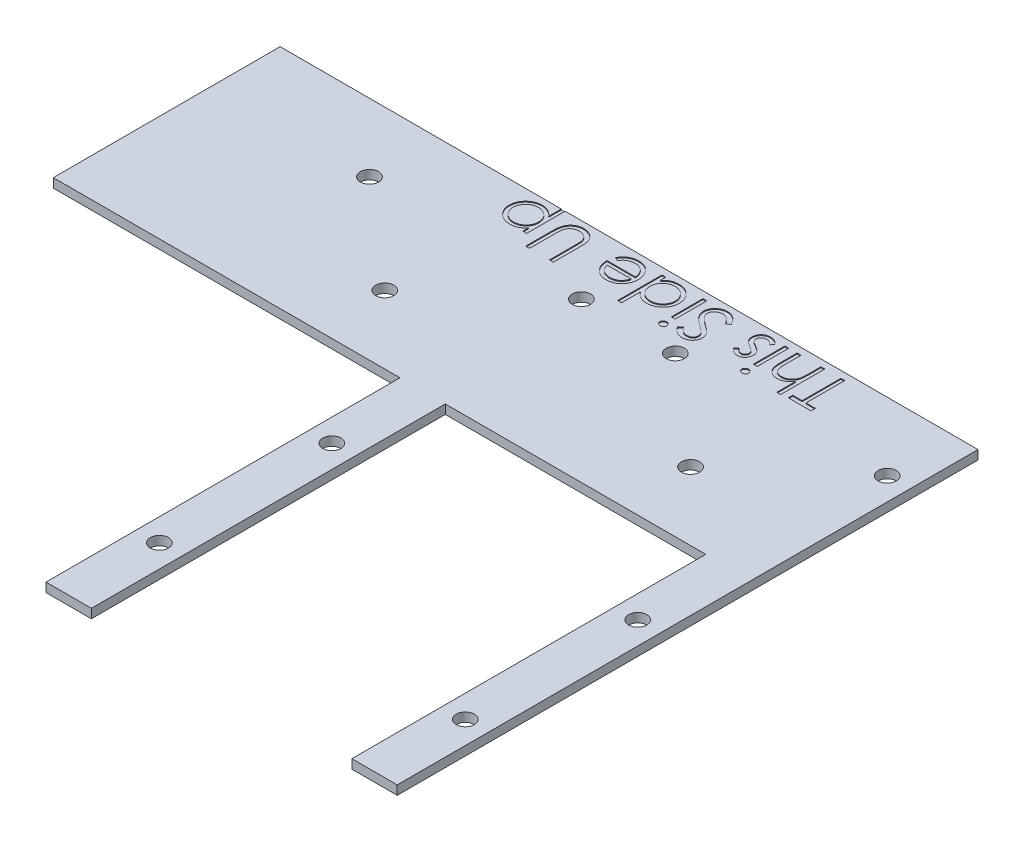
from build123d import *

# Parameters (mm, degrees)
SKETCH1_W           = 2
SKETCH1_H           = 50
SKETCH1_R           = 2
SKETCH1_W_2         = 8.7
SKETCH1_W_3         = 10
SKETCH1_H_2         = 78
SKETCH1_W_4         = 29.7
BOSS_EXTRUDE1_DEPTH = 2
SKETCH2_W           = 0.854807693
SKETCH2_H           = 6.960576923
CUT_EXTRUDE1_DEPTH  = 0.2


with BuildPart() as part:
    # Sketch1 → Boss-Extrude1 (new body)
    # profile 1 of 7: a face of its own
    with BuildSketch(Plane(origin=(0, 0, 0), x_dir=(1, 0, 0), z_dir=(0, 1, 0))):
        with Locations((38.05, 0)):
            Rectangle(SKETCH1_W, SKETCH1_H)
    # profile 2 of 7: a face of its own
    with BuildSketch(Plane(origin=(0, 0, 0), x_dir=(1, 0, 0), z_dir=(0, 1, 0))):
        Polygon((95.75, 25), (39.05, 25), (39.05, -25), (85.75, -25), (95.75, -25), align=None)
        with Locations(Location((67.4, -10, 0), (0, 0, 270))):
            Circle(SKETCH1_R, mode=Mode.SUBTRACT)
        with Locations(Location((44.05, 10, 0), (0, 0, 270))):
            Circle(SKETCH1_R, mode=Mode.SUBTRACT)
        with Locations(Location((90.75, 10, 0), (0, 0, 270))):
            Circle(SKETCH1_R, mode=Mode.SUBTRACT)
    # profile 3 of 7: a face of its own
    with BuildSketch(Plane(origin=(0, 0, 0), x_dir=(1, 0, 0), z_dir=(0, 1, 0))):
        with Locations((32.7, 0)):
            Rectangle(SKETCH1_W_2, SKETCH1_H)
    # profile 4 of 7: a face of its own
    with BuildSketch(Plane(origin=(0, 0, 0), x_dir=(1, 0, 0), z_dir=(0, 1, 0))):
        with Locations((90.75, -64)):
            Rectangle(SKETCH1_W_3, SKETCH1_H_2)
        with Locations(Location((90.75, -83, 0), (0, 0, 270))):
            Circle(SKETCH1_R, mode=Mode.SUBTRACT)
        with Locations(Location((90.75, -45, 0), (0, 0, 270))):
            Circle(SKETCH1_R, mode=Mode.SUBTRACT)
    # profile 5 of 7: a face of its own
    with BuildSketch(Plane(origin=(0, 0, 0), x_dir=(1, 0, 0), z_dir=(0, 1, 0))):
        Polygon((28.35, -25), (28.35, 25), (-28.35, 25), (-28.35, -25), (18.35, -25), align=None)
        with Locations(Location((0, -10, 0), (0, 0, 270))):
            Circle(SKETCH1_R, mode=Mode.SUBTRACT)
        with Locations(Location((-23.35, 10, 0), (0, 0, 270))):
            Circle(SKETCH1_R, mode=Mode.SUBTRACT)
        with Locations(Location((23.35, 10, 0), (0, 0, 270))):
            Circle(SKETCH1_R, mode=Mode.SUBTRACT)
    # profile 6 of 7: a face of its own
    with BuildSketch(Plane(origin=(0, 0, 0), x_dir=(1, 0, 0), z_dir=(0, 1, 0))):
        with Locations((-43.2, 0)):
            Rectangle(SKETCH1_W_4, SKETCH1_H)
    # profile 7 of 7: a face of its own
    with BuildSketch(Plane(origin=(0, 0, 0), x_dir=(1, 0, 0), z_dir=(0, 1, 0))):
        with Locations((23.35, -64)):
            Rectangle(SKETCH1_W_3, SKETCH1_H_2)
        with Locations(Location((23.35, -83, 0), (0, 0, 270))):
            Circle(SKETCH1_R, mode=Mode.SUBTRACT)
        with Locations(Location((23.35, -45, 0), (0, 0, 270))):
            Circle(SKETCH1_R, mode=Mode.SUBTRACT)
    extrude(amount=BOSS_EXTRUDE1_DEPTH)

    # Sketch2 → Cut-Extrude1 (cut)
    # profile 1 of 12: a face of its own
    with BuildSketch(Plane(origin=(0, 2, 0), x_dir=(1, 0, 0), z_dir=(0, 1, 0))):
        with BuildLine():
            Line((4.759615385, 16.539423077), (3.904807692, 16.539423077))
            Line((3.904807692, 16.539423077), (3.904807692, 17.827358774))
            add(Edge.make_bspline(
                [(3.904807692, 17.827358774), (3.813743751, 17.711435136), (3.636217432, 17.485445611), (3.334891802, 17.188412777), (3.009625504, 16.944809007), (2.665842405, 16.747320075), (2.300156627, 16.600726472), (1.916667217, 16.492715786), (1.5110623, 16.428897878), (1.233759293, 16.421222204), (1.09233774, 16.417307692)],
                knots=[0, 0, 0, 0, 1.079470681, 2.104394496, 3.089609837, 4.049760214, 5.000876222, 5.968810619, 6.964115249, 8, 8, 8, 8], degree=3))
            add(Edge.make_bspline(
                [(1.09233774, 16.417307692), (0.968807735, 16.420881415), (0.724644189, 16.427945065), (0.365243544, 16.475768878), (0.019144822, 16.557732027), (-0.311693954, 16.675844518), (-0.63081701, 16.821864047), (-0.93350001, 17.006151122), (-1.224457615, 17.21952797), (-1.496372387, 17.465088323), (-1.747618394, 17.730776677), (-1.964914073, 18.016587376), (-2.152344041, 18.313121272), (-2.303846776, 18.624975466), (-2.422523779, 18.949694227), (-2.506928009, 19.288589484), (-2.557159167, 19.640404722), (-2.563898653, 19.879625697), (-2.567307692, 20.00063101)],
                knots=[0, 0, 0, 0, 1.041296284, 2.058176809, 3.050446431, 4.034000596, 5.01514041, 6.003636468, 7.015969324, 8.052561599, 9.08815499, 10.094063707, 11.074456064, 12.040834395, 13.011057502, 13.983766392, 14.980127149, 16, 16, 16, 16], degree=3))
            add(Edge.make_bspline(
                [(-2.567307692, 20.00063101), (-2.56399116, 20.124197219), (-2.557450479, 20.367887615), (-2.506171134, 20.725618866), (-2.425575201, 21.070427212), (-2.304768233, 21.399031178), (-2.156859662, 21.716185117), (-1.971794206, 22.016529091), (-1.754652263, 22.302926359), (-1.506106127, 22.570545784), (-1.236573931, 22.817144497), (-0.948381668, 23.032673792), (-0.645829282, 23.214455158), (-0.330363027, 23.364178519), (-0.000880744, 23.479575436), (0.342439899, 23.561267019), (0.699673309, 23.612089542), (0.942705705, 23.61874781), (1.065625, 23.622115385)],
                knots=[0, 0, 0, 0, 1.038787011, 2.048637893, 3.033314735, 4.011256821, 4.987456671, 5.971770257, 6.972013799, 8.005388554, 9.039095487, 10.040396776, 11.026510796, 12.002710647, 12.972028308, 13.95670515, 14.966556032, 16, 16, 16, 16], degree=3))
            add(Edge.make_bspline(
                [(1.065625, 23.622115385), (1.204550969, 23.618419288), (1.477618712, 23.611154378), (1.878331032, 23.543578644), (2.261788631, 23.435885309), (2.627051407, 23.280379785), (2.976667424, 23.086058555), (3.305684376, 22.843506975), (3.621324961, 22.563848295), (3.80914146, 22.348478053), (3.904807692, 22.238777043)],
                knots=[0, 0, 0, 0, 1.019216655, 2.003334536, 2.974394125, 3.93700843, 4.911195144, 5.904014639, 6.932388669, 8, 8, 8, 8], degree=3))
            Line((3.904807692, 22.238777043), (3.904807692, 26.064423077))
            Line((3.904807692, 26.064423077), (4.759615385, 26.064423077))
            Line((4.759615385, 26.064423077), (4.759615385, 16.539423077))
        make_face()
        with BuildLine():
            add(Edge.make_bspline(
                [(1.099969952, 17.272115385), (1.196795901, 17.273860397), (1.387421237, 17.277295876), (1.666854766, 17.318009321), (1.935924096, 17.377302973), (2.191769227, 17.466182517), (2.436472021, 17.577873406), (2.670457039, 17.712825709), (2.889789325, 17.877102678), (3.097067483, 18.061143265), (3.286431821, 18.262918336), (3.452181652, 18.480233147), (3.591648786, 18.710095238), (3.707285781, 18.951309101), (3.795313573, 19.205606705), (3.857783765, 19.471582059), (3.897055529, 19.749514803), (3.902196056, 19.93880658), (3.904807692, 20.034975962)],
                knots=[0, 0, 0, 0, 1.056783697, 2.080534709, 3.078213817, 4.062450963, 5.032388505, 6.013014931, 7.006476528, 8.020136409, 9.037574406, 10.02408906, 10.99988041, 11.969394914, 12.94050107, 13.932990591, 14.949859205, 16, 16, 16, 16], degree=3))
            add(Edge.make_bspline(
                [(3.904807692, 20.034975962), (3.900403353, 20.161193601), (3.891774879, 20.408464646), (3.82395687, 20.769775589), (3.708014756, 21.110093649), (3.549271044, 21.429914641), (3.349503082, 21.724431521), (3.107123907, 21.987198055), (2.826300967, 22.217313825), (2.510500905, 22.41190369), (2.171449527, 22.568967654), (1.81902694, 22.685000153), (1.455642582, 22.75386247), (1.210289347, 22.762801683), (1.086613582, 22.767307692)],
                knots=[0, 0, 0, 0, 1.03769607, 2.032934487, 3.010626162, 3.986202239, 4.961259226, 5.927576439, 6.916221152, 7.938198981, 8.97036853, 9.982809098, 10.983189979, 12, 12, 12, 12], degree=3))
            add(Edge.make_bspline(
                [(1.086613582, 22.767307692), (0.965412861, 22.763071966), (0.724851219, 22.754664811), (0.37063238, 22.681901069), (0.026407892, 22.570735349), (-0.300694747, 22.408682133), (-0.607582697, 22.209918085), (-0.885776651, 21.971786645), (-1.126340846, 21.693114106), (-1.335846583, 21.386759297), (-1.501854969, 21.05709268), (-1.624862029, 20.716099874), (-1.697233019, 20.365565961), (-1.707404349, 20.128791153), (-1.7125, 20.010171274)],
                knots=[0, 0, 0, 0, 1.001026069, 1.986856787, 2.977862212, 3.984342003, 4.995015878, 5.994217425, 7.000312571, 8.029930354, 9.055188864, 10.043064731, 11.019610969, 12, 12, 12, 12], degree=3))
            add(Edge.make_bspline(
                [(-1.7125, 20.010171274), (-1.708524162, 19.890832777), (-1.700603462, 19.65308555), (-1.623166651, 19.30252143), (-1.505534891, 18.960761923), (-1.339302557, 18.633721605), (-1.132230775, 18.330337766), (-0.891448957, 18.056558666), (-0.614545132, 17.822182073), (-0.310057326, 17.623251799), (0.019951951, 17.467993435), (0.366280181, 17.353800729), (0.728388818, 17.285347886), (0.97502005, 17.276565018), (1.099969952, 17.272115385)],
                knots=[0, 0, 0, 0, 0.983964174, 1.960262275, 2.950024098, 3.962167997, 4.978769863, 5.975637987, 6.962679854, 7.964734575, 8.970044757, 9.964711476, 10.968869031, 12, 12, 12, 12], degree=3))
        make_face(mode=Mode.SUBTRACT)
    # profile 2 of 12: a face of its own
    with BuildSketch(Plane(origin=(0, 2, 0), x_dir=(1, 0, 0), z_dir=(0, 1, 0))):
        with BuildLine():
            Line((13.185576923, 13.975), (12.330769231, 13.975))
            Line((12.330769231, 13.975), (12.330769231, 19.681986178))
            add(Edge.make_bspline(
                [(12.330769231, 19.681986178), (12.330896441, 19.76276018), (12.331137845, 19.916042769), (12.329525361, 20.134215073), (12.325009508, 20.328177979), (12.322162459, 20.498679147), (12.315828787, 20.644936195), (12.310663388, 20.767741505), (12.304021588, 20.866513584), (12.296039318, 20.924155962), (12.292608173, 20.948933293)],
                knots=[0, 0, 0, 0, 1.528628734, 2.90083645, 4.128790002, 5.200304208, 6.127813768, 6.898992206, 7.526736466, 8, 8, 8, 8], degree=3))
            add(Edge.make_bspline(
                [(12.292608173, 20.948933293), (12.278692431, 21.039016706), (12.251828717, 21.212918684), (12.18019884, 21.460251276), (12.085485292, 21.684341852), (11.964781153, 21.88769417), (11.815908114, 22.071738016), (11.632228331, 22.238242846), (11.414120914, 22.387688343), (11.166545215, 22.518778605), (10.902589952, 22.627502161), (10.631914266, 22.708895306), (10.359688775, 22.758698925), (10.177413427, 22.764451217), (10.086899038, 22.767307692)],
                knots=[0, 0, 0, 0, 1.042923073, 2.013316119, 2.939979093, 3.821796737, 4.712412725, 5.640305549, 6.650442997, 7.732186751, 8.842579391, 9.91407549, 10.964170509, 12, 12, 12, 12], degree=3))
            add(Edge.make_bspline(
                [(10.086899038, 22.767307692), (10.009185101, 22.764401647), (9.854206081, 22.75860634), (9.624059569, 22.722272631), (9.399191647, 22.658094841), (9.181417359, 22.57062561), (8.974095271, 22.463233304), (8.782799364, 22.333688992), (8.609544173, 22.184991754), (8.453300428, 22.017838212), (8.317304556, 21.831204056), (8.200232715, 21.626061661), (8.104578823, 21.400774832), (8.056525724, 21.242005402), (8.031926082, 21.160727163)],
                knots=[0, 0, 0, 0, 0.994543961, 1.983343699, 2.972712664, 3.980751554, 4.981834161, 5.954730495, 6.930176574, 7.89761099, 8.875938748, 9.87834379, 10.913868493, 12, 12, 12, 12], degree=3))
            add(Edge.make_bspline(
                [(8.031926082, 21.160727163), (8.023761455, 21.1271214), (8.005567376, 21.052234217), (7.98856649, 20.925629848), (7.970859446, 20.776252365), (7.958573366, 20.603028503), (7.946595759, 20.406538713), (7.939430039, 20.185759398), (7.936117971, 19.94149224), (7.935130962, 19.771029679), (7.934615385, 19.681986178)],
                knots=[0, 0, 0, 0, 0.558680831, 1.244966039, 2.062412453, 2.990489873, 4.051219941, 5.244515665, 6.560634259, 8, 8, 8, 8], degree=3))
            Line((7.934615385, 19.681986178), (7.934615385, 13.975))
            Line((7.934615385, 13.975), (7.079807692, 13.975))
            Line((7.079807692, 13.975), (7.079807692, 19.727779447))
            add(Edge.make_bspline(
                [(7.079807692, 19.727779447), (7.080491714, 19.831462562), (7.081826624, 20.033806464), (7.093635203, 20.330294558), (7.111925571, 20.611616177), (7.139554457, 20.877417429), (7.170125586, 21.127997449), (7.213496289, 21.36243843), (7.259619824, 21.582729255), (7.317504225, 21.789276252), (7.386360952, 21.985195945), (7.468359439, 22.174188866), (7.568228933, 22.354554605), (7.681274798, 22.529599596), (7.809811551, 22.697710674), (7.952743187, 22.860192354), (8.11235739, 23.014908593), (8.284631413, 23.162599061), (8.468166574, 23.300923236), (8.665021969, 23.418694927), (8.871673841, 23.518366896), (9.085930521, 23.603260043), (9.311413267, 23.665338335), (9.545313461, 23.711945724), (9.789274963, 23.738311635), (9.95518388, 23.742240998), (10.039197716, 23.744230769)],
                knots=[0, 0, 0, 0, 1.316485072, 2.56920066, 3.767172097, 4.895413872, 5.962239305, 6.971350037, 7.921780903, 8.819233545, 9.69278517, 10.557066787, 11.431700348, 12.307563454, 13.200791052, 14.11626757, 15.05287325, 16.020813301, 16.99640464, 17.967304965, 18.928075993, 19.907403966, 20.889159767, 21.893313923, 22.933205135, 24, 24, 24, 24], degree=3))
            add(Edge.make_bspline(
                [(10.039197716, 23.744230769), (10.130826443, 23.742096567), (10.310601678, 23.737909269), (10.575490797, 23.713877822), (10.829473259, 23.668728438), (11.075027867, 23.610867298), (11.309782289, 23.532369042), (11.533667346, 23.435915622), (11.749253704, 23.325799388), (11.951684255, 23.195679696), (12.142619599, 23.053792931), (12.316136171, 22.897945876), (12.476638703, 22.734073988), (12.617052601, 22.556006663), (12.742688787, 22.367389105), (12.850778803, 22.167334155), (12.943624349, 21.956109999), (12.99153817, 21.809279057), (13.015760216, 21.735051082)],
                knots=[0, 0, 0, 0, 1.138939089, 2.234594419, 3.301501784, 4.342532435, 5.367382236, 6.373123747, 7.370098489, 8.372230273, 9.360297234, 10.323289009, 11.268038109, 12.20748145, 13.137029304, 14.081414587, 15.030090602, 16, 16, 16, 16], degree=3))
            add(Edge.make_bspline(
                [(13.015760216, 21.735051082), (13.029849483, 21.684343861), (13.060409415, 21.574358771), (13.093135403, 21.39233197), (13.120646547, 21.182741372), (13.146515245, 20.945572633), (13.161779623, 20.680641924), (13.175162081, 20.388064089), (13.185671201, 20.06748535), (13.185609227, 19.844179847), (13.185576923, 19.727779447)],
                knots=[0, 0, 0, 0, 0.625038921, 1.35572334, 2.194682327, 3.136881307, 4.189498639, 5.346923369, 6.617055217, 8, 8, 8, 8], degree=3))
            Line((13.185576923, 19.727779447), (13.185576923, 13.975))
        make_face()
    # profile 3 of 12: a face of its own
    with BuildSketch(Plane(origin=(0, 2, 0), x_dir=(1, 0, 0), z_dir=(0, 1, 0))):
        with BuildLine():
            Line((19.928635817, 21.301923077), (19.169230769, 21.70070613))
            add(Edge.make_bspline(
                [(19.169230769, 21.70070613), (19.229786542, 21.808014101), (19.347604095, 22.016792919), (19.549242508, 22.303790425), (19.762809869, 22.559555686), (19.992550372, 22.78288801), (20.235581989, 22.97903384), (20.495523958, 23.147101901), (20.768051004, 23.293024512), (21.057116056, 23.4119594), (21.362443304, 23.505574126), (21.685913746, 23.574679147), (22.029024231, 23.614760651), (22.263987035, 23.61962473), (22.38429988, 23.622115385)],
                knots=[0, 0, 0, 0, 1.120547187, 2.180141081, 3.186367408, 4.148075574, 5.090720713, 6.023293347, 6.960451315, 7.899733127, 8.862572377, 9.862522039, 10.90550313, 12, 12, 12, 12], degree=3))
            add(Edge.make_bspline(
                [(22.38429988, 23.622115385), (22.518036261, 23.618993429), (22.778917196, 23.612903397), (23.158664662, 23.560400337), (23.516204324, 23.474750545), (23.85151632, 23.355101523), (24.163778638, 23.198816949), (24.453615063, 23.008428008), (24.722537933, 22.784907944), (24.962117673, 22.52633887), (25.177669825, 22.249576425), (25.368345355, 21.961377808), (25.525909803, 21.661864544), (25.660397295, 21.355584029), (25.759906098, 21.03845996), (25.83419866, 20.713286361), (25.87582516, 20.378872444), (25.882309307, 20.152746038), (25.885576923, 20.038792067)],
                knots=[0, 0, 0, 0, 1.145213001, 2.233978795, 3.276616913, 4.289988888, 5.2768102, 6.260573508, 7.254647871, 8.264498533, 9.273731702, 10.25749501, 11.220258744, 12.169609138, 13.119022067, 14.062790212, 15.023763961, 16, 16, 16, 16], degree=3))
            add(Edge.make_bspline(
                [(25.885576923, 20.038792067), (25.882694546, 19.931853993), (25.876982054, 19.719916852), (25.840975411, 19.406229906), (25.777162557, 19.101352474), (25.689596989, 18.805031227), (25.576518241, 18.517762305), (25.438181987, 18.239370875), (25.27437273, 17.970153173), (25.147900668, 17.800327502), (25.084194712, 17.714783654)],
                knots=[0, 0, 0, 0, 1.024358464, 2.0301432, 3.019427413, 4.004406732, 4.986367066, 5.972626655, 6.978780325, 8, 8, 8, 8], degree=3))
            add(Edge.make_bspline(
                [(25.084194712, 17.714783654), (24.998053281, 17.611555353), (24.82877586, 17.408700348), (24.539496819, 17.144586185), (24.230479204, 16.918659097), (23.898614667, 16.734347331), (23.544462216, 16.592582443), (23.169848542, 16.491746952), (22.773738223, 16.429002504), (22.502200266, 16.421265231), (22.363311298, 16.417307692)],
                knots=[0, 0, 0, 0, 1.030811313, 2.025658015, 2.997072178, 3.962767568, 4.930766827, 5.917075773, 6.934604948, 8, 8, 8, 8], degree=3))
            add(Edge.make_bspline(
                [(22.363311298, 16.417307692), (22.220570679, 16.420974184), (21.940546124, 16.428167005), (21.532360383, 16.495446574), (21.145368052, 16.600844063), (20.782762782, 16.754403199), (20.438957359, 16.944750238), (20.121864427, 17.185339982), (19.822779577, 17.463815458), (19.648875162, 17.678198188), (19.560381611, 17.787289663)],
                knots=[0, 0, 0, 0, 1.056389096, 2.072394598, 3.055233004, 4.020130009, 4.981825462, 5.957811105, 6.960805292, 8, 8, 8, 8], degree=3))
            add(Edge.make_bspline(
                [(19.560381611, 17.787289663), (19.500164728, 17.869486553), (19.380131786, 18.033333204), (19.229780749, 18.300498996), (19.099268124, 18.580018542), (18.994947709, 18.876410136), (18.910475924, 19.186161994), (18.849361295, 19.511488491), (18.813521119, 19.852292749), (18.806476164, 20.084502875), (18.802884615, 20.202884615)],
                knots=[0, 0, 0, 0, 0.94817472, 1.890038105, 2.849395472, 3.817997239, 4.812318967, 5.836947057, 6.897266129, 8, 8, 8, 8], degree=3))
            Line((18.802884615, 20.202884615), (25.030769231, 20.202884615))
            add(Edge.make_bspline(
                [(25.030769231, 20.202884615), (25.026575323, 20.294596167), (25.018328173, 20.474943234), (24.979971372, 20.738868659), (24.919217989, 20.99016057), (24.834769022, 21.227748272), (24.728878732, 21.452411847), (24.603242911, 21.665699649), (24.45244009, 21.864372497), (24.284515445, 22.051004941), (24.097508391, 22.21714664), (23.900839984, 22.365966442), (23.691928908, 22.490008172), (23.472881171, 22.592209014), (23.242560777, 22.67086963), (23.001291614, 22.725038003), (22.749824226, 22.761225202), (22.578414778, 22.765255753), (22.491150841, 22.767307692)],
                knots=[0, 0, 0, 0, 1.094405546, 2.152104367, 3.174987145, 4.173015398, 5.153654967, 6.133208507, 7.119289451, 8.123438607, 9.122504012, 10.097966803, 11.060604936, 12.014205423, 12.976096155, 13.956823727, 14.959826266, 16, 16, 16, 16], degree=3))
            add(Edge.make_bspline(
                [(22.491150841, 22.767307692), (22.405825033, 22.765677754), (22.236522263, 22.762443643), (21.983874887, 22.730070823), (21.7347388, 22.679614531), (21.49234454, 22.606402754), (21.260573962, 22.519819039), (21.044132702, 22.418582342), (20.845053179, 22.304475984), (20.659341878, 22.172786154), (20.480189531, 22.012843637), (20.301901658, 21.812874202), (20.112444718, 21.574961383), (19.992211086, 21.396360743), (19.928635817, 21.301923077)],
                knots=[0, 0, 0, 0, 0.991026944, 1.966387566, 2.954903586, 3.941705208, 4.905318989, 5.827751054, 6.715113263, 7.568237245, 8.468614997, 9.499196909, 10.677664282, 12, 12, 12, 12], degree=3))
        make_face()
        with BuildLine():
            add(Edge.make_bspline(
                [(19.657692308, 19.348076923), (19.688799683, 19.23461065), (19.748515737, 19.01679227), (19.876494856, 18.715977403), (20.013942218, 18.445555034), (20.18273137, 18.212363262), (20.373749096, 18.006361574), (20.595069915, 17.82742357), (20.839382078, 17.663291172), (21.111127162, 17.526466322), (21.399802368, 17.414068765), (21.699414218, 17.331411846), (22.007469595, 17.282825899), (22.214951775, 17.275702339), (22.319426082, 17.272115385)],
                knots=[0, 0, 0, 0, 1.154958961, 2.217145986, 3.207012531, 4.129872728, 5.036522214, 5.960144231, 6.920619777, 7.92424629, 8.943461387, 9.961007416, 10.973298156, 12, 12, 12, 12], degree=3))
            add(Edge.make_bspline(
                [(22.319426082, 17.272115385), (22.404745444, 17.273767712), (22.573403885, 17.277034017), (22.821813919, 17.308426763), (23.061425922, 17.359540426), (23.291091203, 17.432672822), (23.511328528, 17.52463238), (23.723148376, 17.635305008), (23.924001182, 17.769964848), (24.049562611, 17.872745205), (24.112995793, 17.924669471)],
                knots=[0, 0, 0, 0, 1.04879286, 2.073242986, 3.073461291, 4.057960153, 5.032623303, 6.005244481, 6.992256684, 8, 8, 8, 8], degree=3))
            add(Edge.make_bspline(
                [(24.112995793, 17.924669471), (24.158432488, 17.965743255), (24.250385283, 18.048866584), (24.373120861, 18.192160599), (24.49151223, 18.34676645), (24.596720212, 18.519432827), (24.69670478, 18.705152591), (24.787816645, 18.905280895), (24.870659773, 19.120662483), (24.91716464, 19.270821965), (24.941090745, 19.348076923)],
                knots=[0, 0, 0, 0, 0.879905587, 1.780714457, 2.708106151, 3.677566983, 4.684151534, 5.740052498, 6.837288539, 8, 8, 8, 8], degree=3))
            Line((24.941090745, 19.348076923), (19.657692308, 19.348076923))
        make_face(mode=Mode.SUBTRACT)
    # profile 4 of 12: a face of its own
    with BuildSketch(Plane(origin=(0, 2, 0), x_dir=(1, 0, 0), z_dir=(0, 1, 0))):
        with BuildLine():
            Line((27.595192308, 13.730769231), (27.595192308, 23.5))
            Line((27.595192308, 23.5), (28.45, 23.5))
            Line((28.45, 23.5), (28.45, 22.29601863))
            add(Edge.make_bspline(
                [(28.45, 22.29601863), (28.546520295, 22.404833284), (28.735160977, 22.617502242), (29.047208401, 22.897050521), (29.380711144, 23.125287931), (29.729987366, 23.310548683), (30.097740581, 23.450201743), (30.481810995, 23.548585595), (30.881898099, 23.612585687), (31.154735821, 23.61891032), (31.292998798, 23.622115385)],
                knots=[0, 0, 0, 0, 1.074235403, 2.099501444, 3.086304576, 4.053325556, 5.01427503, 5.985443889, 6.979105517, 8, 8, 8, 8], degree=3))
            add(Edge.make_bspline(
                [(31.292998798, 23.622115385), (31.415920492, 23.618778454), (31.658327516, 23.612197879), (32.014908987, 23.561129646), (32.358077773, 23.479160717), (32.688052582, 23.365022208), (33.002597565, 23.214402619), (33.303485098, 23.032132112), (33.591417401, 22.817202986), (33.860918603, 22.570536413), (34.109405389, 22.3029048), (34.32680623, 22.016620204), (34.511060521, 21.715614738), (34.662484548, 21.399973002), (34.779664401, 21.069925729), (34.861189872, 20.725699339), (34.912203072, 20.367866606), (34.918780314, 20.12419015), (34.922115385, 20.00063101)],
                knots=[0, 0, 0, 0, 1.034036272, 2.039165313, 3.024406509, 3.999331371, 4.971254918, 5.953351348, 6.95522652, 7.989525907, 9.023492927, 10.024309745, 11.009187477, 11.988246066, 12.964946762, 13.950187958, 14.960617622, 16, 16, 16, 16], degree=3))
            add(Edge.make_bspline(
                [(34.922115385, 20.00063101), (34.918706343, 19.879625701), (34.911966852, 19.640404732), (34.861735729, 19.288589443), (34.777331368, 18.949694374), (34.658654851, 18.624974917), (34.507150302, 18.313123321), (34.319727254, 18.016579517), (34.102404754, 17.73080722), (33.851262272, 17.464970641), (33.579342198, 17.220305304), (33.289798943, 17.004853859), (32.98624282, 16.823050677), (32.668065158, 16.675262365), (32.337518935, 16.557820776), (31.992093168, 16.47595268), (31.633358715, 16.427827345), (31.389819292, 16.420847936), (31.266286058, 16.417307692)],
                knots=[0, 0, 0, 0, 1.02050356, 2.017480486, 2.990790918, 3.96161403, 4.928589988, 5.909588639, 6.91611943, 7.952353252, 8.989586576, 9.99823133, 10.991940466, 11.968822692, 12.952985106, 13.945868367, 14.958059758, 16, 16, 16, 16], degree=3))
            add(Edge.make_bspline(
                [(31.266286058, 16.417307692), (31.124160198, 16.421498161), (30.845182929, 16.429723584), (30.43712933, 16.500809242), (30.0497487, 16.61459306), (29.683055916, 16.776217219), (29.340269664, 16.986852055), (29.016807615, 17.240162881), (28.717625921, 17.542517997), (28.540568741, 17.770096749), (28.45, 17.886508413)],
                knots=[0, 0, 0, 0, 1.03083325, 2.023411113, 2.996083796, 3.9549903, 4.922369457, 5.908572979, 6.930187902, 8, 8, 8, 8], degree=3))
            Line((28.45, 17.886508413), (28.45, 13.730769231))
            Line((28.45, 13.730769231), (27.595192308, 13.730769231))
        make_face()
        with BuildLine():
            add(Edge.make_bspline(
                [(31.25483774, 17.272115385), (31.379787717, 17.27656497), (31.626419098, 17.285347743), (31.988526647, 17.353801281), (32.334858965, 17.467991374), (32.664852851, 17.623259575), (32.969397771, 17.822153349), (33.246090993, 18.056664531), (33.487431837, 18.329666331), (33.691492312, 18.634886489), (33.860900324, 18.960135647), (33.97780501, 19.302613155), (34.055453632, 19.653062541), (34.06334605, 19.890825087), (34.067307692, 20.010171274)],
                knots=[0, 0, 0, 0, 1.031179624, 2.035384561, 3.030098214, 4.035455833, 5.037557836, 6.024646278, 7.02156144, 8.035264006, 9.049836703, 10.039645228, 11.015989397, 12, 12, 12, 12], degree=3))
            add(Edge.make_bspline(
                [(34.067307692, 20.010171274), (34.062164992, 20.128775067), (34.05189975, 20.365517765), (33.980190489, 20.716504201), (33.854319952, 21.056747313), (33.688617668, 21.386189087), (33.481345019, 21.693685856), (33.240480511, 21.971728489), (32.962383293, 22.209854652), (32.655156668, 22.409310587), (32.327370403, 22.569756861), (31.982541714, 22.682920126), (31.626680856, 22.75437042), (31.384281957, 22.762980762), (31.262469952, 22.767307692)],
                knots=[0, 0, 0, 0, 0.979235476, 1.954632679, 2.943119654, 3.967171814, 4.992637064, 5.997548408, 6.995574264, 8.005058949, 9.015076297, 9.999929117, 10.994910263, 12, 12, 12, 12], degree=3))
            add(Edge.make_bspline(
                [(31.262469952, 22.767307692), (31.13879251, 22.762805974), (30.893435947, 22.753875274), (30.530076333, 22.684949647), (30.178107489, 22.569341668), (29.840395803, 22.411917747), (29.526323248, 22.216750376), (29.24575009, 21.987251003), (29.003361868, 21.724431326), (28.803795113, 21.42986176), (28.644343973, 21.11048743), (28.53144047, 20.769364636), (28.462866858, 20.408520452), (28.454348256, 20.16121246), (28.45, 20.034975962)],
                knots=[0, 0, 0, 0, 1.017730373, 2.019016736, 3.032373701, 4.060729657, 5.079187105, 6.068726676, 7.03591854, 8.011858086, 8.988317194, 9.965225429, 10.961364673, 12, 12, 12, 12], degree=3))
            add(Edge.make_bspline(
                [(28.45, 20.034975962), (28.452611678, 19.938806617), (28.457752285, 19.749514914), (28.49702346, 19.471581639), (28.559495812, 19.205608226), (28.647515745, 18.951303557), (28.763181957, 18.710115963), (28.902538981, 18.480154869), (29.068445235, 18.263562331), (29.255851769, 18.060612645), (29.463298187, 17.876428144), (29.683890568, 17.714089471), (29.917073902, 17.576706284), (30.162684508, 17.466763799), (30.418830676, 17.377196414), (30.687967518, 17.318038704), (30.967382629, 17.277288172), (31.158010502, 17.273857802), (31.25483774, 17.272115385)],
                knots=[0, 0, 0, 0, 1.050062701, 2.066855696, 3.059271411, 4.030305351, 4.999747758, 5.975466543, 6.961907836, 7.974539719, 8.98812422, 9.98710676, 10.961662635, 11.93785114, 12.922015094, 13.919620009, 14.94329489, 16, 16, 16, 16], degree=3))
        make_face(mode=Mode.SUBTRACT)
    # profile 5 of 12: a face of its own
    with BuildSketch(Plane(origin=(0, 2, 0), x_dir=(1, 0, 0), z_dir=(0, 1, 0))):
        with BuildLine():
            add(Edge.make_bspline(
                [(37.062950721, 13.608653846), (37.009915354, 13.611125106), (36.906061919, 13.615964306), (36.755731584, 13.657073579), (36.618983073, 13.727819219), (36.495880365, 13.819648785), (36.393833878, 13.932084929), (36.320661116, 14.059837242), (36.273947847, 14.198915523), (36.268273633, 14.295822306), (36.265384615, 14.34516226)],
                knots=[0, 0, 0, 0, 1.054986045, 2.065865298, 3.074122704, 4.105114675, 5.109626121, 6.074217918, 7.019490725, 8, 8, 8, 8], degree=3))
            add(Edge.make_bspline(
                [(36.265384615, 14.34516226), (36.268338263, 14.393221502), (36.274177274, 14.488228936), (36.320626583, 14.624895776), (36.394447345, 14.750869166), (36.495812443, 14.863085489), (36.619001012, 14.954862005), (36.755726838, 15.025621661), (36.906063168, 15.06672723), (37.009915776, 15.071566941), (37.062950721, 15.074038462)],
                knots=[0, 0, 0, 0, 0.961106377, 1.899993565, 2.859409042, 3.870007927, 4.90724781, 5.921615355, 6.938620636, 8, 8, 8, 8], degree=3))
            add(Edge.make_bspline(
                [(37.062950721, 15.074038462), (37.115376548, 15.071646318), (37.21741657, 15.066990323), (37.364982772, 15.025129868), (37.499530951, 14.955015877), (37.620620469, 14.861815425), (37.723995275, 14.75161533), (37.797543659, 14.62480062), (37.844117159, 14.488253163), (37.849939434, 14.39322964), (37.852884615, 14.34516226)],
                knots=[0, 0, 0, 0, 1.055304112, 2.054011575, 3.063363921, 4.096942562, 5.122536081, 6.088009498, 7.032825006, 8, 8, 8, 8], degree=3))
            add(Edge.make_bspline(
                [(37.852884615, 14.34516226), (37.850004378, 14.295813858), (37.844347411, 14.198890485), (37.797507511, 14.059934026), (37.72461631, 13.931332399), (37.620553675, 13.820917928), (37.499548437, 13.727665685), (37.364978219, 13.657565237), (37.217417778, 13.615701242), (37.115376958, 13.611045738), (37.062950721, 13.608653846)],
                knots=[0, 0, 0, 0, 0.986662878, 1.937868148, 2.908513651, 3.927890639, 4.955204348, 5.958438607, 6.951092507, 8, 8, 8, 8], degree=3))
        make_face()
    # profile 6 of 12: a face of its own
    with BuildSketch(Plane(origin=(0, 2, 0), x_dir=(1, 0, 0), z_dir=(0, 1, 0))):
        with Locations((37.059134615, 20.019711539)):
            Rectangle(SKETCH2_W, SKETCH2_H)
    # profile 7 of 12: a face of its own
    with BuildSketch(Plane(origin=(0, 2, 0), x_dir=(1, 0, 0), z_dir=(0, 1, 0))):
        with BuildLine():
            Line((44.691346154, 21.662545072), (43.886147837, 21.179807692))
            add(Edge.make_bspline(
                [(43.886147837, 21.179807692), (43.811258919, 21.305168626), (43.667774644, 21.545355336), (43.428421303, 21.869907575), (43.180409594, 22.145757444), (42.921902908, 22.371300212), (42.654479149, 22.548870396), (42.376392546, 22.67460647), (42.088580218, 22.753027089), (41.892708604, 22.762552324), (41.794921875, 22.767307692)],
                knots=[0, 0, 0, 0, 1.272034388, 2.437168799, 3.508375237, 4.49857839, 5.41946034, 6.295179144, 7.148887113, 8, 8, 8, 8], degree=3))
            add(Edge.make_bspline(
                [(41.794921875, 22.767307692), (41.711426674, 22.76492643), (41.545897243, 22.760205572), (41.301733794, 22.71667682), (41.065788152, 22.645464104), (40.840408628, 22.548926734), (40.631555868, 22.430264236), (40.44550376, 22.29032868), (40.288302642, 22.128674281), (40.158339954, 21.951129629), (40.056603011, 21.761400806), (39.984214752, 21.564160325), (39.937714104, 21.360665053), (39.931818488, 21.222667702), (39.928846154, 21.153094952)],
                knots=[0, 0, 0, 0, 1.095645842, 2.172120455, 3.244862764, 4.326153987, 5.384857088, 6.392105572, 7.372507978, 8.334705661, 9.272564127, 10.189475455, 11.087205874, 12, 12, 12, 12], degree=3))
            add(Edge.make_bspline(
                [(39.928846154, 21.153094952), (39.932772211, 21.073763741), (39.940722905, 20.913109389), (40.010792898, 20.675677219), (40.117786846, 20.439695992), (40.218349132, 20.293698907), (40.27038762, 20.218149038)],
                knots=[0, 0, 0, 0, 0.938992559, 1.901562324, 2.914110574, 4, 4, 4, 4], degree=3))
            add(Edge.make_bspline(
                [(40.27038762, 20.218149038), (40.312907078, 20.163474601), (40.402433385, 20.048355529), (40.558608735, 19.880006021), (40.736189949, 19.701754962), (40.939774668, 19.517160214), (41.16639419, 19.322445746), (41.418617742, 19.121222773), (41.693500221, 18.910490135), (41.88738284, 18.771307287), (41.987635216, 18.699338942)],
                knots=[0, 0, 0, 0, 0.722283655, 1.520795216, 2.39349503, 3.346893347, 4.386874146, 5.510198126, 6.712579003, 8, 8, 8, 8], degree=3))
            add(Edge.make_bspline(
                [(41.987635216, 18.699338942), (42.087835724, 18.627943377), (42.279411465, 18.491440492), (42.547532279, 18.289111335), (42.786969851, 18.102946154), (42.998944235, 17.935538164), (43.177971383, 17.779585875), (43.330596029, 17.643447458), (43.451187272, 17.519853278), (43.518293454, 17.439739945), (43.548422476, 17.403771034)],
                knots=[0, 0, 0, 0, 1.452255772, 2.776602448, 3.96446981, 5.032613149, 5.964194703, 6.766668629, 7.446264616, 8, 8, 8, 8], degree=3))
            add(Edge.make_bspline(
                [(43.548422476, 17.403771034), (43.590522845, 17.347704), (43.673318871, 17.237440655), (43.782728357, 17.065146236), (43.874993674, 16.889110395), (43.949250004, 16.708695139), (44.009298285, 16.525256396), (44.051047245, 16.337416979), (44.076780421, 16.146452054), (44.079438584, 16.017968333), (44.080769231, 15.953650841)],
                knots=[0, 0, 0, 0, 1.068019517, 2.100403715, 3.106014851, 4.09224787, 5.069873182, 6.043214339, 7.020455327, 8, 8, 8, 8], degree=3))
            add(Edge.make_bspline(
                [(44.080769231, 15.953650841), (44.07723285, 15.85286832), (44.070235676, 15.653457434), (44.010571176, 15.362305948), (43.917510619, 15.083472344), (43.782873326, 14.82316245), (43.61657108, 14.581745273), (43.419169997, 14.363503348), (43.186973313, 14.175948828), (42.928479107, 14.016512494), (42.648841653, 13.88931786), (42.354959088, 13.796635881), (42.048151965, 13.742318584), (41.839656137, 13.734656842), (41.733864183, 13.730769231)],
                knots=[0, 0, 0, 0, 1.005367131, 1.989245246, 2.955191616, 3.932180104, 4.904534562, 5.875498653, 6.859376768, 7.874484044, 8.900379497, 9.918679785, 10.943926428, 12, 12, 12, 12], degree=3))
            add(Edge.make_bspline(
                [(41.733864183, 13.730769231), (41.621586622, 13.734515823), (41.398926793, 13.741945762), (41.071308911, 13.810520331), (40.753996216, 13.917067308), (40.499694993, 14.043962704), (40.300593608, 14.169335154), (40.148917063, 14.283819009), (39.994376763, 14.41533317), (39.838637818, 14.566663717), (39.680161491, 14.734779889), (39.519678136, 14.921105989), (39.355685793, 15.123962569), (39.250220416, 15.268815443), (39.196153846, 15.343073918)],
                knots=[0, 0, 0, 0, 1.286534051, 2.551350862, 3.822568981, 5.117864672, 5.799956111, 6.519305446, 7.295594771, 8.126302591, 9.008831062, 9.944975596, 10.946496709, 12, 12, 12, 12], degree=3))
            Line((39.196153846, 15.343073918), (39.968915264, 15.928846154))
            add(Edge.make_bspline(
                [(39.968915264, 15.928846154), (40.015573293, 15.86872988), (40.105425746, 15.752959992), (40.241894823, 15.590887211), (40.370325274, 15.442639757), (40.497828728, 15.31421427), (40.614576809, 15.195992321), (40.72990141, 15.09657489), (40.839347374, 15.01280578), (40.976987859, 14.923291322), (41.151791665, 14.836685423), (41.369176694, 14.762224993), (41.596500156, 14.716464643), (41.750825035, 14.710648563), (41.829266827, 14.707692308)],
                knots=[0, 0, 0, 0, 1.181426797, 2.275151783, 3.28963443, 4.225459815, 5.084396437, 5.868484344, 6.587427557, 7.222918358, 8.415355282, 9.605213164, 10.782753814, 12, 12, 12, 12], degree=3))
            add(Edge.make_bspline(
                [(41.829266827, 14.707692308), (41.927687441, 14.710935867), (42.117482322, 14.717190765), (42.386307734, 14.787301225), (42.629661815, 14.893899456), (42.838254567, 15.047612993), (43.010486368, 15.230869136), (43.136618312, 15.439859861), (43.212030385, 15.670681985), (43.221260692, 15.831619064), (43.225961538, 15.913581731)],
                knots=[0, 0, 0, 0, 1.144248881, 2.206576175, 3.214949548, 4.222996039, 5.203671638, 6.127710127, 7.046472867, 8, 8, 8, 8], degree=3))
            add(Edge.make_bspline(
                [(43.225961538, 15.913581731), (43.224779997, 15.964587428), (43.222400456, 16.067309353), (43.194030542, 16.218762014), (43.151694393, 16.368431727), (43.091684072, 16.517180809), (43.010129336, 16.669246991), (42.899363687, 16.823763527), (42.760755143, 16.98459756), (42.654376735, 17.089101113), (42.598212139, 17.144275841)],
                knots=[0, 0, 0, 0, 0.858500039, 1.728959331, 2.587258638, 3.476905708, 4.426389682, 5.487945037, 6.673710648, 8, 8, 8, 8], degree=3))
            add(Edge.make_bspline(
                [(42.598212139, 17.144275841), (42.577362262, 17.162882319), (42.527827725, 17.20708705), (42.43726967, 17.279456042), (42.317682483, 17.368726444), (42.172188921, 17.479181927), (41.998106315, 17.607310763), (41.795415523, 17.751474665), (41.566375923, 17.916353664), (41.403846995, 18.031626685), (41.317908654, 18.092578125)],
                knots=[0, 0, 0, 0, 0.420754252, 0.999615792, 1.744751191, 2.668019286, 3.750313428, 4.999500688, 6.413464383, 8, 8, 8, 8], degree=3))
            add(Edge.make_bspline(
                [(41.317908654, 18.092578125), (41.214532777, 18.167802164), (41.014359719, 18.313463089), (40.729540605, 18.5323079), (40.471297262, 18.746344646), (40.238703911, 18.95419258), (40.029526687, 19.154321569), (39.845874219, 19.348984187), (39.68691323, 19.536903865), (39.513443245, 19.776190246), (39.338289982, 20.072794475), (39.188110454, 20.436354403), (39.092568811, 20.800957636), (39.080160587, 21.045698164), (39.074038462, 21.166451322)],
                knots=[0, 0, 0, 0, 1.163604038, 2.253157948, 3.268574773, 4.215621239, 5.091738613, 5.902582348, 6.650434646, 7.330118262, 8.591011492, 9.77460283, 10.902005569, 12, 12, 12, 12], degree=3))
            add(Edge.make_bspline(
                [(39.074038462, 21.166451322), (39.075829633, 21.251843723), (39.079377193, 21.420970263), (39.120051288, 21.669337385), (39.179856435, 21.910454617), (39.268988814, 22.141321363), (39.380406875, 22.364510651), (39.516057474, 22.579631148), (39.680450554, 22.783148192), (39.863071543, 22.979014141), (40.065917256, 23.156155528), (40.280569438, 23.313932578), (40.505823294, 23.44902481), (40.744251183, 23.555156267), (40.991925549, 23.640052357), (41.250008994, 23.700903641), (41.519056089, 23.738377823), (41.701940045, 23.742258007), (41.794921875, 23.744230769)],
                knots=[0, 0, 0, 0, 0.98378539, 1.948466333, 2.894822735, 3.844243623, 4.795447569, 5.768042124, 6.770299647, 7.807997672, 8.852593179, 9.870666288, 10.876941106, 11.874841786, 12.874492863, 13.892063892, 14.928283473, 16, 16, 16, 16], degree=3))
            add(Edge.make_bspline(
                [(41.794921875, 23.744230769), (41.866860597, 23.742823685), (42.009832048, 23.740027236), (42.220736499, 23.715890531), (42.427768091, 23.680493746), (42.628327356, 23.626526517), (42.824911386, 23.559507625), (43.015768765, 23.477453305), (43.201359895, 23.379769497), (43.381914032, 23.266305104), (43.559083759, 23.135507301), (43.732154041, 22.984487453), (43.901991262, 22.813968434), (44.069300906, 22.624187537), (44.230141783, 22.412007819), (44.388558559, 22.180794202), (44.543726353, 21.929799721), (44.641220478, 21.753293874), (44.691346154, 21.662545072)],
                knots=[0, 0, 0, 0, 0.915366252, 1.81920441, 2.69897508, 3.586533125, 4.459536084, 5.340758185, 6.227946952, 7.126403341, 8.052553006, 9.028121456, 10.047063623, 11.114014537, 12.24582441, 13.433687931, 14.680555077, 16, 16, 16, 16], degree=3))
        make_face()
    # profile 8 of 12: a face of its own
    with BuildSketch(Plane(origin=(0, 2, 0), x_dir=(1, 0, 0), z_dir=(0, 1, 0))):
        with BuildLine():
            Line((49.453846154, 17.407587139), (50.033894231, 18.004807692))
            add(Edge.make_bspline(
                [(50.033894231, 18.004807692), (50.083934462, 17.946792947), (50.180406136, 17.834947348), (50.333545648, 17.685607357), (50.486042967, 17.559147927), (50.63709378, 17.455093455), (50.786979971, 17.373201625), (50.936981282, 17.315362287), (51.086686089, 17.279050961), (51.186804691, 17.274399478), (51.235967548, 17.272115385)],
                knots=[0, 0, 0, 0, 1.265880991, 2.440469525, 3.530740057, 4.536711111, 5.468008477, 6.34654737, 7.188078389, 8, 8, 8, 8], degree=3))
            add(Edge.make_bspline(
                [(51.235967548, 17.272115385), (51.296194935, 17.27507672), (51.414713909, 17.280904208), (51.584410243, 17.337662084), (51.740021502, 17.427264458), (51.877733878, 17.549434841), (51.992712475, 17.694211565), (52.078891416, 17.854727737), (52.130461128, 18.028408655), (52.137045229, 18.14820825), (52.140384615, 18.208969351)],
                knots=[0, 0, 0, 0, 0.999905305, 1.967672129, 2.944835807, 3.972828834, 5.013019963, 6.007753697, 6.989553527, 8, 8, 8, 8], degree=3))
            add(Edge.make_bspline(
                [(52.140384615, 18.208969351), (52.137361619, 18.263974985), (52.131324148, 18.373831194), (52.084388543, 18.535886915), (52.009641589, 18.693884997), (51.939781989, 18.790666907), (51.903786058, 18.840534856)],
                knots=[0, 0, 0, 0, 0.960159726, 1.917612774, 2.927026955, 4, 4, 4, 4], degree=3))
            add(Edge.make_bspline(
                [(51.903786058, 18.840534856), (51.882002498, 18.867044958), (51.835358201, 18.923810019), (51.750753851, 19.004594426), (51.650531403, 19.089065609), (51.533739337, 19.176650488), (51.400142903, 19.267440815), (51.251699948, 19.362978842), (51.086575827, 19.460467937), (50.97028607, 19.524563967), (50.909690505, 19.55796274)],
                knots=[0, 0, 0, 0, 0.667332049, 1.428932371, 2.272176193, 3.217953793, 4.268659351, 5.415594948, 6.6533338, 8, 8, 8, 8], degree=3))
            add(Edge.make_bspline(
                [(50.909690505, 19.55796274), (50.835617443, 19.599433208), (50.69253268, 19.679540496), (50.48944003, 19.804170975), (50.304033715, 19.927212092), (50.138873711, 20.05147704), (49.99008734, 20.17185424), (49.860065449, 20.291671453), (49.748405337, 20.411245368), (49.685951548, 20.494900276), (49.65609976, 20.534885817)],
                knots=[0, 0, 0, 0, 1.271974443, 2.457035787, 3.569878245, 4.604907449, 5.553098313, 6.436573686, 7.252710343, 8, 8, 8, 8], degree=3))
            add(Edge.make_bspline(
                [(49.65609976, 20.534885817), (49.606219409, 20.615506341), (49.506757302, 20.77626478), (49.408100945, 21.042456953), (49.343253001, 21.32170332), (49.335621242, 21.513337501), (49.331730769, 21.611027644)],
                knots=[0, 0, 0, 0, 0.995678878, 1.985397446, 2.973007791, 4, 4, 4, 4], degree=3))
            add(Edge.make_bspline(
                [(49.331730769, 21.611027644), (49.333684594, 21.679797928), (49.337534818, 21.815317284), (49.364425064, 22.014862546), (49.410338083, 22.2058399), (49.473933987, 22.389403692), (49.555639284, 22.565059361), (49.65748912, 22.731563028), (49.777662349, 22.888881621), (49.911478318, 23.039078108), (50.06092341, 23.175547247), (50.222258373, 23.293720342), (50.390616168, 23.396527952), (50.569697521, 23.478282254), (50.75725246, 23.543985588), (50.954348891, 23.589275603), (51.160157812, 23.616430971), (51.300121651, 23.620196622), (51.371439303, 23.622115385)],
                knots=[0, 0, 0, 0, 1.032810722, 2.035266353, 3.017676364, 3.978389067, 4.948507077, 5.921677479, 6.903715858, 7.918386526, 8.939467451, 9.936812204, 10.918153393, 11.89693397, 12.887853058, 13.89815236, 14.929017384, 16, 16, 16, 16], degree=3))
            add(Edge.make_bspline(
                [(51.371439303, 23.622115385), (51.467693321, 23.619426058), (51.658863916, 23.614084772), (51.941521878, 23.563541276), (52.218304507, 23.485802132), (52.485234917, 23.374967472), (52.738235313, 23.238706418), (52.97108581, 23.077487463), (53.181363755, 22.892162811), (53.301480226, 22.750412443), (53.361538462, 22.67953726)],
                knots=[0, 0, 0, 0, 1.014105853, 2.01412079, 3.018242674, 4.040740662, 5.055023907, 6.042888753, 7.021444376, 8, 8, 8, 8], degree=3))
            Line((53.361538462, 22.67953726), (52.794846755, 22.034615385))
            add(Edge.make_bspline(
                [(52.794846755, 22.034615385), (52.741037545, 22.092730851), (52.636720256, 22.20539647), (52.469893373, 22.355413425), (52.300132289, 22.481146885), (52.129132178, 22.586312178), (51.954361778, 22.667343811), (51.776800499, 22.72427227), (51.596809502, 22.760859679), (51.475917833, 22.765154861), (51.415324519, 22.767307692)],
                knots=[0, 0, 0, 0, 1.179806542, 2.287233372, 3.337373186, 4.324005949, 5.273901747, 6.200048787, 7.097828587, 8, 8, 8, 8], degree=3))
            add(Edge.make_bspline(
                [(51.415324519, 22.767307692), (51.332817059, 22.763576758), (51.171611323, 22.756287138), (50.940706513, 22.690114584), (50.72754568, 22.586329134), (50.542302575, 22.439208182), (50.38553912, 22.268043806), (50.269738537, 22.07594235), (50.199571722, 21.866337796), (50.190921363, 21.720946481), (50.186538462, 21.647280649)],
                knots=[0, 0, 0, 0, 1.072236613, 2.094970478, 3.102399718, 4.141104368, 5.155589565, 6.110053346, 7.042415349, 8, 8, 8, 8], degree=3))
            add(Edge.make_bspline(
                [(50.186538462, 21.647280649), (50.189403461, 21.586539565), (50.195030914, 21.467231501), (50.241981629, 21.294137463), (50.312994236, 21.129003746), (50.384822934, 21.032294742), (50.421228966, 20.983278245)],
                knots=[0, 0, 0, 0, 1.014054094, 1.991812201, 2.982159616, 4, 4, 4, 4], degree=3))
            add(Edge.make_bspline(
                [(50.421228966, 20.983278245), (50.443056615, 20.95868241), (50.490605117, 20.905103797), (50.57793379, 20.827879159), (50.681665051, 20.744110014), (50.806406194, 20.658863981), (50.94586364, 20.564428198), (51.107485851, 20.470778348), (51.285008672, 20.368640297), (51.41068637, 20.301136698), (51.476382212, 20.265850361)],
                knots=[0, 0, 0, 0, 0.615029206, 1.339755737, 2.178261527, 3.109653826, 4.166232585, 5.329982127, 6.604294388, 8, 8, 8, 8], degree=3))
            add(Edge.make_bspline(
                [(51.476382212, 20.265850361), (51.547266282, 20.226283152), (51.684733116, 20.149549708), (51.879443958, 20.030035232), (52.055104972, 19.908476435), (52.215942964, 19.791692208), (52.357895415, 19.673525211), (52.480403103, 19.553844262), (52.588289283, 19.437476014), (52.648017597, 19.355024085), (52.676547476, 19.315640024)],
                knots=[0, 0, 0, 0, 1.262093308, 2.447601706, 3.550203992, 4.582594899, 5.537233252, 6.418365656, 7.244515135, 8, 8, 8, 8], degree=3))
            add(Edge.make_bspline(
                [(52.676547476, 19.315640024), (52.7258171, 19.236297538), (52.824059255, 19.078090994), (52.921143062, 18.813697412), (52.986034694, 18.534598799), (52.992100805, 18.341648532), (52.995192308, 18.243314303)],
                knots=[0, 0, 0, 0, 0.984940175, 1.963941237, 2.962352981, 4, 4, 4, 4], degree=3))
            add(Edge.make_bspline(
                [(52.995192308, 18.243314303), (52.993740251, 18.179018768), (52.990898371, 18.053183298), (52.96816644, 17.868302531), (52.926911563, 17.692603287), (52.874563312, 17.52310364), (52.803328541, 17.362919689), (52.716967318, 17.210385667), (52.613552222, 17.067973452), (52.497186824, 16.934706738), (52.370749386, 16.812317233), (52.232136236, 16.707623383), (52.087123516, 16.616829243), (51.9325391, 16.544111601), (51.770357459, 16.486320404), (51.599315303, 16.447175684), (51.420595368, 16.420844977), (51.298396458, 16.418503768), (51.235967548, 16.417307692)],
                knots=[0, 0, 0, 0, 1.087410352, 2.12821612, 3.143409386, 4.13688077, 5.124334423, 6.102425883, 7.096654197, 8.095527921, 9.09231389, 10.067027194, 11.028349958, 11.981147348, 12.950860869, 13.934615631, 14.944837612, 16, 16, 16, 16], degree=3))
            add(Edge.make_bspline(
                [(51.235967548, 16.417307692), (51.161962658, 16.420306041), (51.012564623, 16.426358985), (50.788499038, 16.4746535), (50.565017338, 16.553302233), (50.341890473, 16.664477056), (50.118167826, 16.804309066), (49.894852205, 16.976423214), (49.668315424, 17.175961172), (49.526933253, 17.328653361), (49.453846154, 17.407587139)],
                knots=[0, 0, 0, 0, 0.845753203, 1.707371858, 2.609134499, 3.549244224, 4.552329203, 5.621587647, 6.770486714, 8, 8, 8, 8], degree=3))
        make_face()
    # profile 9 of 12: a face of its own
    with BuildSketch(Plane(origin=(0, 2, 0), x_dir=(1, 0, 0), z_dir=(0, 1, 0))):
        with BuildLine():
            add(Edge.make_bspline(
                [(55.136027644, 13.608653846), (55.082992277, 13.611125106), (54.979138842, 13.615964306), (54.828808507, 13.657073579), (54.692059996, 13.727819219), (54.568957288, 13.819648785), (54.466910801, 13.932084929), (54.393738039, 14.059837242), (54.34702477, 14.198915523), (54.341350556, 14.295822306), (54.338461538, 14.34516226)],
                knots=[0, 0, 0, 0, 1.054986045, 2.065865298, 3.074122704, 4.105114675, 5.109626121, 6.074217918, 7.019490725, 8, 8, 8, 8], degree=3))
            add(Edge.make_bspline(
                [(54.338461538, 14.34516226), (54.341415186, 14.393221502), (54.347254197, 14.488228936), (54.393703507, 14.624895776), (54.467524268, 14.750869166), (54.568889366, 14.863085489), (54.692077935, 14.954862005), (54.828803761, 15.025621661), (54.979140091, 15.06672723), (55.082992699, 15.071566941), (55.136027644, 15.074038462)],
                knots=[0, 0, 0, 0, 0.961106377, 1.899993565, 2.859409042, 3.870007927, 4.90724781, 5.921615355, 6.938620636, 8, 8, 8, 8], degree=3))
            add(Edge.make_bspline(
                [(55.136027644, 15.074038462), (55.188453471, 15.071646318), (55.290493493, 15.066990323), (55.438059695, 15.025129868), (55.572607874, 14.955015877), (55.693697392, 14.861815425), (55.797072198, 14.75161533), (55.870620582, 14.62480062), (55.917194082, 14.488253163), (55.923016357, 14.39322964), (55.925961538, 14.34516226)],
                knots=[0, 0, 0, 0, 1.055304112, 2.054011575, 3.063363921, 4.096942562, 5.122536081, 6.088009498, 7.032825006, 8, 8, 8, 8], degree=3))
            add(Edge.make_bspline(
                [(55.925961538, 14.34516226), (55.923081301, 14.295813858), (55.917424334, 14.198890485), (55.870584434, 14.059934026), (55.797693233, 13.931332399), (55.693630598, 13.820917928), (55.57262536, 13.727665685), (55.438055142, 13.657565237), (55.290494701, 13.615701242), (55.188453881, 13.611045738), (55.136027644, 13.608653846)],
                knots=[0, 0, 0, 0, 0.986662878, 1.937868148, 2.908513651, 3.927890639, 4.955204348, 5.958438607, 6.951092507, 8, 8, 8, 8], degree=3))
        make_face()
    # profile 10 of 12: a face of its own
    with BuildSketch(Plane(origin=(0, 2, 0), x_dir=(1, 0, 0), z_dir=(0, 1, 0))):
        with Locations((55.132211539, 20.019711539)):
            Rectangle(SKETCH2_W, SKETCH2_H)
    # profile 11 of 12: a face of its own
    with BuildSketch(Plane(origin=(0, 2, 0), x_dir=(1, 0, 0), z_dir=(0, 1, 0))):
        with BuildLine():
            Line((63.497115385, 13.730769231), (62.642307692, 13.730769231))
            Line((62.642307692, 13.730769231), (62.642307692, 17.854071514))
            add(Edge.make_bspline(
                [(62.642307692, 17.854071514), (62.55040236, 17.739539155), (62.371741907, 17.516892627), (62.073076356, 17.223252891), (61.761864665, 16.973141666), (61.435465785, 16.768901871), (61.095266919, 16.610461399), (60.740432115, 16.499615537), (60.371865999, 16.430494519), (60.120799244, 16.421734368), (59.993930288, 16.417307692)],
                knots=[0, 0, 0, 0, 1.12556596, 2.18805719, 3.205172764, 4.182516927, 5.13416184, 6.075333115, 7.027428072, 8, 8, 8, 8], degree=3))
            add(Edge.make_bspline(
                [(59.993930288, 16.417307692), (59.86506188, 16.421788824), (59.612708884, 16.430563875), (59.246606516, 16.507883193), (58.902285309, 16.630242349), (58.584344717, 16.802209114), (58.297694151, 17.015727613), (58.049071146, 17.266148034), (57.840503985, 17.550172106), (57.700957099, 17.814915699), (57.609497809, 18.050349324), (57.551684008, 18.252396401), (57.502639471, 18.477512769), (57.45991578, 18.725612737), (57.431439275, 18.997878018), (57.408566891, 19.293083105), (57.392302344, 19.611210218), (57.391672057, 19.831428903), (57.391346154, 19.945297476)],
                knots=[0, 0, 0, 0, 1.235689485, 2.419754739, 3.574485241, 4.732583367, 5.875375667, 6.993392835, 8.106934443, 9.24564317, 9.854426656, 10.528623913, 11.260290605, 12.06517837, 12.94359002, 13.886555271, 14.907200199, 16, 16, 16, 16], degree=3))
            Line((57.391346154, 19.945297476), (57.391346154, 23.5))
            Line((57.391346154, 23.5), (58.246153846, 23.5))
            Line((58.246153846, 23.5), (58.246153846, 20.22578125))
            add(Edge.make_bspline(
                [(58.246153846, 20.22578125), (58.246669672, 20.13101372), (58.247656359, 19.949739565), (58.250958046, 19.690209093), (58.258160818, 19.45544572), (58.270230462, 19.244962114), (58.282375345, 19.059043525), (58.299593622, 18.897386275), (58.319477167, 18.761004491), (58.337354787, 18.678913687), (58.345372596, 18.642097356)],
                knots=[0, 0, 0, 0, 1.430934443, 2.737134061, 3.918973087, 4.976914145, 5.92044225, 6.731742364, 7.431207999, 8, 8, 8, 8], degree=3))
            add(Edge.make_bspline(
                [(58.345372596, 18.642097356), (58.376318524, 18.533992951), (58.435654714, 18.326711923), (58.576325902, 18.045652609), (58.747934718, 17.8038467), (58.960642007, 17.608162217), (59.207381554, 17.453974842), (59.490495823, 17.3489269), (59.80636713, 17.281936682), (60.02854066, 17.275486677), (60.144666466, 17.272115385)],
                knots=[0, 0, 0, 0, 1.090171874, 2.090312098, 3.036871164, 3.954896932, 4.878889889, 5.844924892, 6.87358393, 8, 8, 8, 8], degree=3))
            add(Edge.make_bspline(
                [(60.144666466, 17.272115385), (60.21343702, 17.273391672), (60.349532169, 17.275917413), (60.55123332, 17.301917312), (60.747500439, 17.342980645), (60.937806747, 17.403634845), (61.122540445, 17.477378885), (61.302452457, 17.567877574), (61.475080574, 17.677300229), (61.642652925, 17.800454341), (61.798646307, 17.936695343), (61.943770222, 18.080519803), (62.073142948, 18.233666726), (62.190350902, 18.393687403), (62.291528988, 18.562774546), (62.379847723, 18.739298181), (62.454784157, 18.923490299), (62.492020626, 19.051329575), (62.510652043, 19.115294471)],
                knots=[0, 0, 0, 0, 1.024369801, 2.02720137, 3.025498567, 4.008789058, 4.999724648, 5.987391013, 7.005161842, 8.042127274, 9.083588116, 10.088924978, 11.084112559, 12.068088063, 13.041783903, 14.016724555, 15.007660144, 16, 16, 16, 16], degree=3))
            add(Edge.make_bspline(
                [(62.510652043, 19.115294471), (62.521372913, 19.161615773), (62.544735008, 19.262555592), (62.570084661, 19.429037145), (62.592775379, 19.622493629), (62.611957504, 19.84263162), (62.623722475, 20.090257786), (62.636399544, 20.363682325), (62.64111854, 20.664617953), (62.641899461, 20.873883584), (62.642307692, 20.983278245)],
                knots=[0, 0, 0, 0, 0.607992626, 1.324890765, 2.152360218, 3.099583803, 4.150613268, 5.323148443, 6.60066238, 8, 8, 8, 8], degree=3))
            Line((62.642307692, 20.983278245), (62.642307692, 23.5))
            Line((62.642307692, 23.5), (63.497115385, 23.5))
            Line((63.497115385, 23.5), (63.497115385, 13.730769231))
        make_face()
    # profile 12 of 12: a face of its own
    with BuildSketch(Plane(origin=(0, 2, 0), x_dir=(1, 0, 0), z_dir=(0, 1, 0))):
        Polygon((69.969230769, 14.951923077), (69.969230769, 13.975), (64.9625, 13.975), (64.9625, 14.951923077), (67.038461538, 14.951923077), (67.038461538, 23.5), (67.893269231, 23.5), (67.893269231, 14.951923077), align=None)
    extrude(amount=-CUT_EXTRUDE1_DEPTH, mode=Mode.SUBTRACT)


solid = part.part
